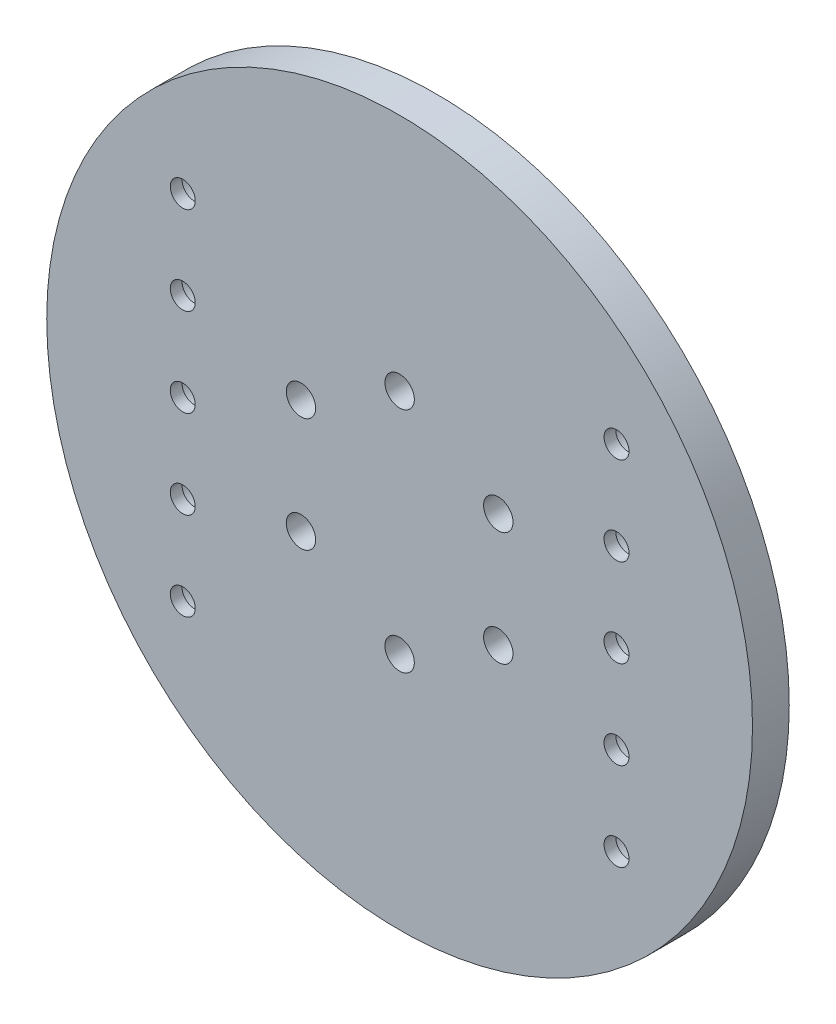
from build123d import *

# Parameters (mm, degrees)
SKETCH_1_R                   = 48
EXTRUDE_1_DEPTH              = 5
HOLE_WIZARD_M3_1_AT_2_COUNT  = 2
HOLE_WIZARD_M3_1_AT_2_PITCH  = 12
HOLE_WIZARD_M3_1_AT_3_COUNT  = 2
HOLE_WIZARD_M3_1_AT_3_PITCH  = 24
HOLE_WIZARD_M3_1_AT_4_COUNT  = 2
HOLE_WIZARD_M3_1_AT_4_PITCH  = 36
HOLE_WIZARD_M3_1_AT_5_COUNT  = 2
HOLE_WIZARD_M3_1_AT_5_PITCH  = 48
HOLE_WIZARD_M3_1_AT_6_COUNT  = 2
HOLE_WIZARD_M3_1_AT_6_PITCH  = 59
HOLE_WIZARD_M3_1_AT_7_COUNT  = 2
HOLE_WIZARD_M3_1_AT_7_PITCH  = 60.207972894
HOLE_WIZARD_M3_1_AT_8_COUNT  = 2
HOLE_WIZARD_M3_1_AT_8_PITCH  = 63.694583757
HOLE_WIZARD_M3_1_AT_9_COUNT  = 2
HOLE_WIZARD_M3_1_AT_9_PITCH  = 69.115844783
HOLE_WIZARD_M3_1_AT_10_COUNT = 2
HOLE_WIZARD_M3_1_AT_10_PITCH = 76.059187479
CUT_EXTRUDE_1_REACH          = 70.066
SKETCH_5_R                   = 2
PATTERN_CIRCULAR_1_COUNT     = 6


with BuildPart() as part:
    # 草圖1 → 填料-伸長1 (new body)
    with BuildSketch(Plane.XY):
        Circle(SKETCH_1_R)
    extrude(amount=EXTRUDE_1_DEPTH)

    # 草圖4 → M3 六角承窩頭蓋螺釘的柱孔1 (revolve, cut)
    with BuildSketch(Plane(origin=(-29.5, 24, 0), x_dir=(0, 1, 0), z_dir=(1, 0, 0))):
        Polygon((0, 0), (0, 5), (1.7, 5), (1.7, 3.4), (3.25, 3.4), (3.25, 0.025), (3.275, 0), align=None)
    hole_wizard_m3_1 = revolve(axis=Axis((-29.5, 24, -6.35), (0, 0, 1)), mode=Mode.SUBTRACT)

    # M3 六角承窩頭蓋螺釘的柱孔1 at 2: M3 六角承窩頭蓋螺釘的柱孔1 ×2
    with Locations(*[(0, -i * HOLE_WIZARD_M3_1_AT_2_PITCH, 0) for i in range(1, HOLE_WIZARD_M3_1_AT_2_COUNT)]):
        add(hole_wizard_m3_1, mode=Mode.SUBTRACT)

    # M3 六角承窩頭蓋螺釘的柱孔1 at 3: M3 六角承窩頭蓋螺釘的柱孔1 ×2
    with Locations(*[(0, -i * HOLE_WIZARD_M3_1_AT_3_PITCH, 0) for i in range(1, HOLE_WIZARD_M3_1_AT_3_COUNT)]):
        add(hole_wizard_m3_1, mode=Mode.SUBTRACT)

    # M3 六角承窩頭蓋螺釘的柱孔1 at 4: M3 六角承窩頭蓋螺釘的柱孔1 ×2
    with Locations(*[(0, -i * HOLE_WIZARD_M3_1_AT_4_PITCH, 0) for i in range(1, HOLE_WIZARD_M3_1_AT_4_COUNT)]):
        add(hole_wizard_m3_1, mode=Mode.SUBTRACT)

    # M3 六角承窩頭蓋螺釘的柱孔1 at 5: M3 六角承窩頭蓋螺釘的柱孔1 ×2
    with Locations(*[(0, -i * HOLE_WIZARD_M3_1_AT_5_PITCH, 0) for i in range(1, HOLE_WIZARD_M3_1_AT_5_COUNT)]):
        add(hole_wizard_m3_1, mode=Mode.SUBTRACT)

    # M3 六角承窩頭蓋螺釘的柱孔1 at 6: M3 六角承窩頭蓋螺釘的柱孔1 ×2
    with Locations(*[(i * HOLE_WIZARD_M3_1_AT_6_PITCH, 0, 0) for i in range(1, HOLE_WIZARD_M3_1_AT_6_COUNT)]):
        add(hole_wizard_m3_1, mode=Mode.SUBTRACT)

    # M3 六角承窩頭蓋螺釘的柱孔1 at 7: M3 六角承窩頭蓋螺釘的柱孔1 ×2
    with Locations(*[Vector(0.9799366622741338, -0.19930915164896565, 0) * (i * HOLE_WIZARD_M3_1_AT_7_PITCH) for i in range(1, HOLE_WIZARD_M3_1_AT_7_COUNT)]):
        add(hole_wizard_m3_1, mode=Mode.SUBTRACT)

    # M3 六角承窩頭蓋螺釘的柱孔1 at 8: M3 六角承窩頭蓋螺釘的柱孔1 ×2
    with Locations(*[Vector(0.9262954009547517, -0.37679812920193184, 0) * (i * HOLE_WIZARD_M3_1_AT_8_PITCH) for i in range(1, HOLE_WIZARD_M3_1_AT_8_COUNT)]):
        add(hole_wizard_m3_1, mode=Mode.SUBTRACT)

    # M3 六角承窩頭蓋螺釘的柱孔1 at 9: M3 六角承窩頭蓋螺釘的柱孔1 ×2
    with Locations(*[Vector(0.8536392803366317, -0.5208646456291284, 0) * (i * HOLE_WIZARD_M3_1_AT_9_PITCH) for i in range(1, HOLE_WIZARD_M3_1_AT_9_COUNT)]):
        add(hole_wizard_m3_1, mode=Mode.SUBTRACT)

    # M3 六角承窩頭蓋螺釘的柱孔1 at 10: M3 六角承窩頭蓋螺釘的柱孔1 ×2
    with Locations(*[Vector(0.7757116786991063, -0.6310874674162169, 0) * (i * HOLE_WIZARD_M3_1_AT_10_PITCH) for i in range(1, HOLE_WIZARD_M3_1_AT_10_COUNT)]):
        add(hole_wizard_m3_1, mode=Mode.SUBTRACT)

    # 草圖5 → 除料-伸長1 (cut, up to next)
    with BuildSketch(Plane(origin=(0, 0, 0), x_dir=(-1, 0, 0), z_dir=(0, 0, -1)), mode=Mode.PRIVATE) as cut_extrude_1_sk1:
        with Locations((0, 15.5)):
            Circle(SKETCH_5_R)
    cut_extrude_1_tool1 = extrude(cut_extrude_1_sk1.sketch, amount=-CUT_EXTRUDE_1_REACH, mode=Mode.PRIVATE) & part.part
    cut_extrude_1 = cut_extrude_1_tool1.solids().sort_by_distance((0, 15.5, 0))[0]
    add(cut_extrude_1, mode=Mode.SUBTRACT)

    # 環狀複製排列1: 除料-伸長1 ×6 about axis
    pattern_circular_1_axis = Axis((0, 0, 0), (0, 0, 1))
    for i in range(1, PATTERN_CIRCULAR_1_COUNT):
        add(cut_extrude_1.rotate(pattern_circular_1_axis, i * 360 / PATTERN_CIRCULAR_1_COUNT), mode=Mode.SUBTRACT)


solid = part.part
